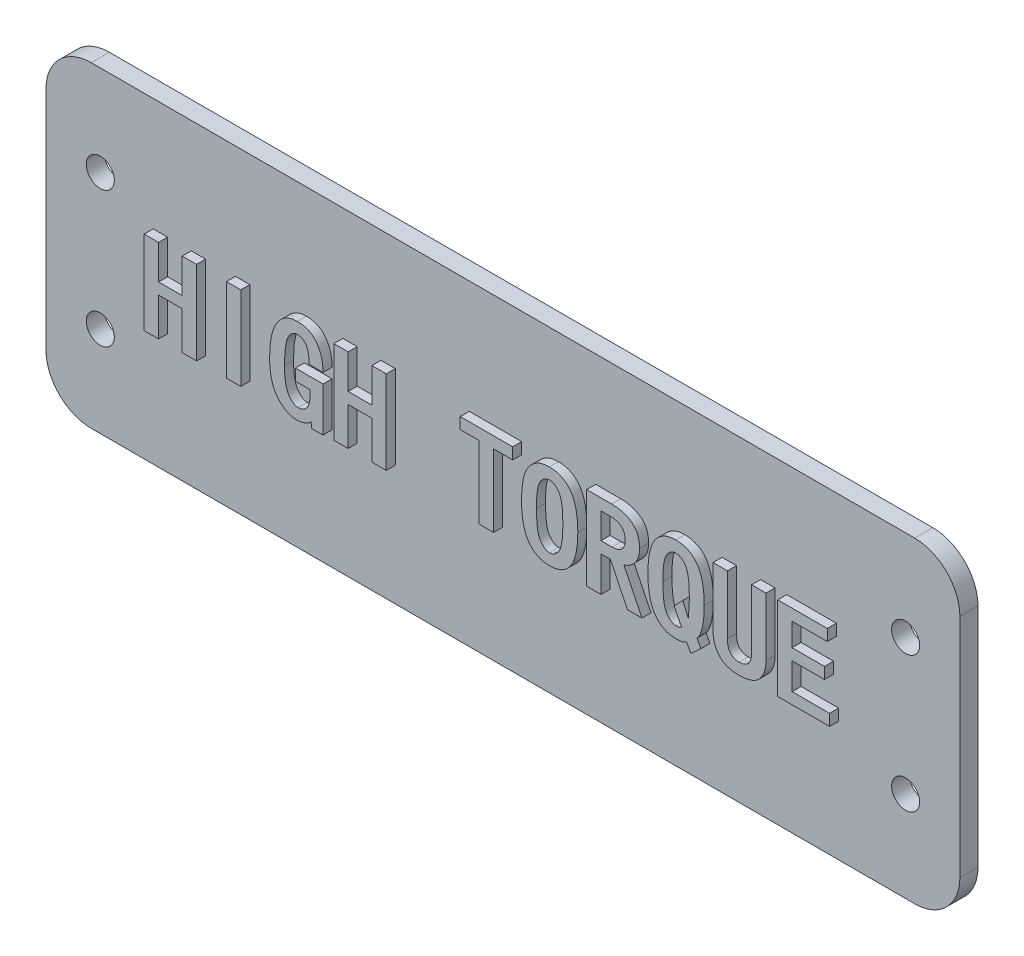
from build123d import *

# Parameters (mm, degrees)
SKETCH_1_W      = 101
SKETCH_1_H      = 35
SKETCH_1_R      = 1.55
EXTRUDE_1_DEPTH = 2
FILLET_1_R      = 5
SKETCH_3_W      = 1.589612312
SKETCH_3_H      = 9.245947265
EXTRUDE_2_DEPTH = 1


with BuildPart() as part:
    # 草图1 → 凸台-拉伸1 (new body)
    with BuildSketch(Plane.XY):
        with Locations((50.5, 17.5)):
            Rectangle(SKETCH_1_W, SKETCH_1_H)
        with Locations((6, 25)):
            Circle(SKETCH_1_R, mode=Mode.SUBTRACT)
        with Locations((95, 25)):
            Circle(SKETCH_1_R, mode=Mode.SUBTRACT)
        with Locations((95, 10)):
            Circle(SKETCH_1_R, mode=Mode.SUBTRACT)
        with Locations((6, 10)):
            Circle(SKETCH_1_R, mode=Mode.SUBTRACT)
    extrude(amount=EXTRUDE_1_DEPTH)

    # 圆角1
    fillet_1_edges = [part.edges().sort_by_distance(p)[0] for p in [
        (0, 35, 1),
        (101, 35, 1),
        (101, 0, 1),
        (0, 0, 1),
    ]]
    fillet(fillet_1_edges, radius=FILLET_1_R)

    # 草图3 → 凸台-拉伸2 (add)
    # profile 1 of 10: a face of its own
    with BuildSketch(Plane.XY.offset(2)):
        Polygon((17.64576391, 13.274972898), (16.056151598, 13.274972898), (16.056151598, 17.482186506), (13.438550301, 17.482186506), (13.438550301, 13.274972898), (11.84893799, 13.274972898), (11.84893799, 22.520920163), (13.438550301, 22.520920163), (13.438550301, 18.734427915), (16.056151598, 18.734427915), (16.056151598, 22.520920163), (17.64576391, 22.520920163), align=None)
    # profile 2 of 10: a face of its own
    with BuildSketch(Plane.XY.offset(2)):
        with Locations((21.732913168, 17.897946531)):
            Rectangle(SKETCH_3_W, SKETCH_3_H)
    # profile 3 of 10: a face of its own
    with BuildSketch(Plane.XY.offset(2)):
        with BuildLine():
            Line((31.616888347, 13.169792558), (30.366631472, 13.169792558))
            Line((30.366631472, 13.169792558), (30.275342875, 13.906054939))
            add(Edge.make_bspline(
                [(30.275342875, 13.906054939), (30.277241291, 13.884822673), (30.281095595, 13.841715367), (30.2634311, 13.776380852), (30.227897618, 13.713207135), (30.174136952, 13.652129339), (30.106994746, 13.587979048), (30.020396113, 13.526757546), (29.915979577, 13.468648749), (29.757995403, 13.385445207), (29.539984375, 13.299955526), (29.264854032, 13.223316562), (28.976856687, 13.179677826), (28.781128146, 13.173121199), (28.681761494, 13.169792558)],
                knots=[0, 0, 0, 0, 0.404685948, 0.821623142, 1.268524009, 1.779947334, 2.370127266, 3.040180568, 3.799017715, 4.652680262, 6.450666371, 8.25994717, 10.10126552, 12, 12, 12, 12], degree=3))
            add(Edge.make_bspline(
                [(28.681761494, 13.169792558), (28.585554633, 13.172309223), (28.395013568, 13.177293567), (28.114802918, 13.233654895), (27.840872812, 13.312275955), (27.577902666, 13.432731377), (27.321211741, 13.581798626), (27.076321157, 13.768038897), (26.837874627, 13.985047777), (26.6075953, 14.233097318), (26.396386493, 14.520349687), (26.210829477, 14.846086423), (26.056368921, 15.212039298), (25.933058926, 15.617635883), (25.834281467, 16.060786739), (25.763523418, 16.542914585), (25.722333947, 17.063385169), (25.717420978, 17.423235622), (25.714882086, 17.609196729)],
                knots=[0, 0, 0, 0, 0.773065135, 1.531082639, 2.292345688, 3.062030965, 3.851778445, 4.676903532, 5.532380376, 6.444095022, 7.395954845, 8.394966231, 9.453945799, 10.585438076, 11.802027254, 13.104463427, 14.503664001, 16, 16, 16, 16], degree=3))
            add(Edge.make_bspline(
                [(25.714882086, 17.609196729), (25.716639045, 17.811696683), (25.720047549, 18.204547077), (25.761240707, 18.773393523), (25.823056048, 19.303636539), (25.911483819, 19.794410429), (26.02594976, 20.247057051), (26.166038131, 20.660124378), (26.330286454, 21.035495531), (26.523095534, 21.369514335), (26.738374381, 21.665271166), (26.972091993, 21.92302213), (27.227344962, 22.140818931), (27.501914021, 22.31783205), (27.7960308, 22.45701407), (28.10881411, 22.556533447), (28.442114193, 22.614762101), (28.670285397, 22.622264681), (28.786941834, 22.626100504)],
                knots=[0, 0, 0, 0, 1.472579312, 2.856807383, 4.145874486, 5.353858625, 6.481139869, 7.538614218, 8.522994793, 9.456374208, 10.33790306, 11.179077366, 11.981201368, 12.77128672, 13.548253789, 14.341030196, 15.151823267, 16, 16, 16, 16], degree=3))
            add(Edge.make_bspline(
                [(28.786941834, 22.626100504), (28.897545102, 22.622843833), (29.11302432, 22.616499131), (29.427398012, 22.573129068), (29.721205737, 22.497344714), (29.996726919, 22.394647214), (30.250325488, 22.258184184), (30.484373271, 22.09229846), (30.698155116, 21.896096413), (30.889897286, 21.671249016), (31.060386471, 21.422513479), (31.208497424, 21.154122291), (31.337091774, 20.868650669), (31.440110237, 20.563495789), (31.518438026, 20.239181775), (31.576213853, 19.897088648), (31.609850968, 19.536854452), (31.614507916, 19.290829328), (31.616888347, 19.16507195)],
                knots=[0, 0, 0, 0, 1.051035015, 2.04764478, 3.008212116, 3.92940237, 4.83501697, 5.736805181, 6.64894196, 7.585132314, 8.538949328, 9.509788216, 10.494670874, 11.510525019, 12.565613027, 13.662137341, 14.804985951, 16, 16, 16, 16], degree=3))
            Line((31.616888347, 19.16507195), (30.078873938, 19.16507195))
            add(Edge.make_bspline(
                [(30.078873938, 19.16507195), (30.077673814, 19.260354545), (30.075355163, 19.444441493), (30.059317865, 19.709947983), (30.034576911, 19.95522447), (29.99732455, 20.178627838), (29.949500395, 20.38080514), (29.89350262, 20.562282858), (29.823319275, 20.722144221), (29.744500478, 20.8626437), (29.653663375, 20.982755672), (29.555511932, 21.087651684), (29.449088618, 21.176623585), (29.333469805, 21.250468852), (29.208526507, 21.304897871), (29.075451258, 21.345462069), (28.934006463, 21.36949292), (28.836647156, 21.372383402), (28.786941834, 21.373859095)],
                knots=[0, 0, 0, 0, 1.586046448, 3.064257943, 4.42625607, 5.688059039, 6.831221944, 7.882951832, 8.844517848, 9.732319319, 10.558205968, 11.34499275, 12.119038461, 12.861418226, 13.620595308, 14.380011941, 15.172939591, 16, 16, 16, 16], degree=3))
            add(Edge.make_bspline(
                [(28.786941834, 21.373859095), (28.733772731, 21.371859936), (28.629326974, 21.367932776), (28.47697188, 21.327835511), (28.333605104, 21.264132539), (28.197459016, 21.174386612), (28.071864863, 21.058649375), (27.952715802, 20.918675019), (27.842767435, 20.75400089), (27.740085525, 20.562410993), (27.648066745, 20.338764503), (27.569746075, 20.078182986), (27.506292239, 19.778466936), (27.449907035, 19.440963946), (27.410948898, 19.063733219), (27.378074651, 18.648271401), (27.361407805, 18.19410854), (27.359216005, 17.878442105), (27.358076835, 17.714377069)],
                knots=[0, 0, 0, 0, 0.593539068, 1.16595228, 1.748883274, 2.341914906, 2.980929397, 3.652601944, 4.393372111, 5.19110308, 6.080058068, 7.093430964, 8.229738948, 9.50442286, 10.918690183, 12.469492685, 14.165047836, 16, 16, 16, 16], degree=3))
            add(Edge.make_bspline(
                [(27.358076835, 17.714377069), (27.359636255, 17.558894979), (27.362617412, 17.261658552), (27.384007062, 16.835235922), (27.420417247, 16.448264089), (27.473864434, 16.100485376), (27.539307432, 15.79136603), (27.622566041, 15.522482548), (27.717473869, 15.290963509), (27.833334994, 15.100055099), (27.956299721, 14.940543487), (28.078931707, 14.803014819), (28.202842587, 14.686412944), (28.327327973, 14.590366155), (28.453583159, 14.516165881), (28.57965944, 14.460974265), (28.70846323, 14.427423692), (28.795352625, 14.423823426), (28.838539737, 14.422033967)],
                knots=[0, 0, 0, 0, 1.891237509, 3.615494755, 5.192022928, 6.616848772, 7.893733796, 9.03138948, 10.037253368, 10.928726721, 11.738245671, 12.484678521, 13.167838939, 13.805152193, 14.393053725, 14.944587119, 15.475422364, 16, 16, 16, 16], degree=3))
            add(Edge.make_bspline(
                [(28.838539737, 14.422033967), (28.888864769, 14.423887952), (28.987912317, 14.427536886), (29.132617449, 14.446426437), (29.269439675, 14.482263502), (29.396381305, 14.535048778), (29.517374651, 14.598172179), (29.628600691, 14.67797818), (29.73038295, 14.773258029), (29.826612231, 14.880165625), (29.912614633, 15.004419306), (29.986133445, 15.146600483), (30.046257519, 15.306273136), (30.099153894, 15.480903775), (30.13454043, 15.674168302), (30.165868912, 15.883076982), (30.180104173, 16.110019828), (30.182709076, 16.266318337), (30.184054278, 16.347032646)],
                knots=[0, 0, 0, 0, 0.907406556, 1.78591827, 2.624610233, 3.448251036, 4.259018942, 5.079547088, 5.906460763, 6.767896505, 7.667514695, 8.62210419, 9.645058048, 10.739124451, 11.905940461, 13.182376014, 14.544947275, 16, 16, 16, 16], degree=3))
            Line((30.184054278, 16.347032646), (30.184054278, 16.797522028))
            Line((30.184054278, 16.797522028), (28.554751272, 16.797522028))
            Line((28.554751272, 16.797522028), (28.554751272, 18.051747971))
            Line((28.554751272, 18.051747971), (31.616888347, 18.051747971))
            Line((31.616888347, 18.051747971), (31.616888347, 13.169792558))
        make_face()
    # profile 4 of 10: a face of its own
    with BuildSketch(Plane.XY.offset(2)):
        Polygon((38.602450565, 13.274972898), (37.012838253, 13.274972898), (37.012838253, 17.482186506), (34.395236956, 17.482186506), (34.395236956, 13.274972898), (32.805624644, 13.274972898), (32.805624644, 22.520920163), (34.395236956, 22.520920163), (34.395236956, 18.734427915), (37.012838253, 18.734427915), (37.012838253, 22.520920163), (38.602450565, 22.520920163), align=None)
    # profile 5 of 10: a face of its own
    with BuildSketch(Plane.XY.offset(2)):
        Polygon((52.573575001, 21.268678754), (50.469968197, 21.268678754), (50.469968197, 13.274972898), (48.880355885, 13.274972898), (48.880355885, 21.268678754), (46.776749081, 21.268678754), (46.776749081, 22.520920163), (52.573575001, 22.520920163), align=None)
    # profile 6 of 10: a face of its own
    with BuildSketch(Plane.XY.offset(2)):
        with BuildLine():
            add(Edge.make_bspline(
                [(59.7694979, 17.924737749), (59.767529619, 17.724900678), (59.763732607, 17.339394764), (59.725849147, 16.78156005), (59.662944962, 16.266160245), (59.577835951, 15.790623188), (59.462076169, 15.358690562), (59.327529575, 14.965687006), (59.162057886, 14.616887258), (58.97346876, 14.307787991), (58.758231474, 14.039016743), (58.522285011, 13.804808985), (58.260845669, 13.609197577), (57.979512268, 13.445655092), (57.672021841, 13.323257082), (57.343237607, 13.234002845), (56.990982713, 13.179286062), (56.748575035, 13.173015022), (56.624010367, 13.169792558)],
                knots=[0, 0, 0, 0, 1.482109731, 2.859139507, 4.144502331, 5.332081044, 6.438947973, 7.458510704, 8.408862517, 9.296700438, 10.13809231, 10.956934706, 11.755744593, 12.553619618, 13.363638007, 14.202809372, 15.076487773, 16, 16, 16, 16], degree=3))
            add(Edge.make_bspline(
                [(56.624010367, 13.169792558), (56.50739223, 13.173229027), (56.279586283, 13.179941946), (55.947756072, 13.232198306), (55.635076725, 13.319604701), (55.34198792, 13.443492952), (55.067273772, 13.60111379), (54.813331329, 13.796205363), (54.578825894, 14.025828573), (54.362174889, 14.290212481), (54.168270547, 14.594531844), (54.002277533, 14.942813633), (53.862085868, 15.333979371), (53.74808939, 15.768405733), (53.659596686, 16.246045508), (53.598250723, 16.76713938), (53.556966312, 17.331359725), (53.553662328, 17.722235156), (53.551950619, 17.924737749)],
                knots=[0, 0, 0, 0, 0.874151028, 1.707597178, 2.511592069, 3.302955925, 4.087402855, 4.880086984, 5.697391014, 6.543377942, 7.437785054, 8.396186257, 9.43022448, 10.549184097, 11.760398197, 13.069650641, 14.481860717, 16, 16, 16, 16], degree=3))
            add(Edge.make_bspline(
                [(53.551950619, 17.924737749), (53.55364424, 18.12724153), (53.556907787, 18.517459243), (53.598275523, 19.080352215), (53.659404225, 19.598841764), (53.748054225, 20.073178854), (53.862127613, 20.503619392), (54.001804127, 20.890431067), (54.168304085, 21.233304071), (54.362212583, 21.531707285), (54.578916112, 21.790145771), (54.814228385, 22.014367859), (55.069077352, 22.204497236), (55.34413345, 22.357586982), (55.636164114, 22.481201392), (55.949328789, 22.565378762), (56.281057601, 22.615389794), (56.5080697, 22.622479577), (56.624010367, 22.626100504)],
                knots=[0, 0, 0, 0, 1.527865662, 2.944143763, 4.256829192, 5.465991544, 6.582474552, 7.613756025, 8.564832938, 9.452382312, 10.292251896, 11.104410477, 11.900155737, 12.684688649, 13.474587384, 14.287206103, 15.125233996, 16, 16, 16, 16], degree=3))
            add(Edge.make_bspline(
                [(56.624010367, 22.626100504), (56.747884088, 22.622644705), (56.989473877, 22.615904892), (57.340553903, 22.56427377), (57.668531112, 22.476259636), (57.975829459, 22.355810842), (58.257957139, 22.195224489), (58.519471441, 22.003105599), (58.7569045, 21.774952961), (58.970719839, 21.510247622), (59.160347896, 21.207121012), (59.325327183, 20.863101978), (59.463021591, 20.476323313), (59.574966628, 20.047115722), (59.663687266, 19.576341562), (59.725729576, 19.063251858), (59.763782794, 18.508110811), (59.767546601, 18.123917821), (59.7694979, 17.924737749)],
                knots=[0, 0, 0, 0, 0.924837789, 1.803702718, 2.64250372, 3.456170252, 4.261304483, 5.059620579, 5.873691894, 6.713089084, 7.594366387, 8.53779121, 9.556616881, 10.655395167, 11.847077938, 13.131347985, 14.512783083, 16, 16, 16, 16], degree=3))
        make_face()
        with BuildLine():
            add(Edge.make_bspline(
                [(58.126303151, 17.924737749), (58.125717154, 18.097429024), (58.124598507, 18.427090358), (58.101154082, 18.897548353), (58.070477556, 19.321029204), (58.019840256, 19.69624411), (57.962045182, 20.024906946), (57.883426848, 20.30438852), (57.798315503, 20.54017991), (57.689482756, 20.728481885), (57.573898374, 20.882482866), (57.453295637, 21.011700142), (57.331217401, 21.12582782), (57.198369985, 21.214021823), (57.063861795, 21.287537133), (56.921850077, 21.337567806), (56.774839188, 21.368180327), (56.674432136, 21.371960694), (56.624010367, 21.373859095)],
                knots=[0, 0, 0, 0, 1.990561811, 3.799909783, 5.42944937, 6.8833502, 8.16368396, 9.272000238, 10.227982531, 11.044303368, 11.768789503, 12.443393091, 13.080532084, 13.689719391, 14.276488615, 14.843344441, 15.419158142, 16, 16, 16, 16], degree=3))
            add(Edge.make_bspline(
                [(56.624010367, 21.373859095), (56.58082751, 21.371984943), (56.494102585, 21.36822105), (56.366105163, 21.336243887), (56.239663522, 21.28863505), (56.115254413, 21.220049583), (55.994974435, 21.13006997), (55.877490053, 21.020969393), (55.759497999, 20.89535859), (55.641675875, 20.74684249), (55.530552306, 20.561854409), (55.443551345, 20.327769127), (55.363180146, 20.048200046), (55.302890042, 19.718290714), (55.253693451, 19.339425319), (55.218756943, 18.911614522), (55.200290438, 18.434266667), (55.196915658, 18.10005392), (55.195145368, 17.924737749)],
                knots=[0, 0, 0, 0, 0.505350126, 1.014903928, 1.537498455, 2.085627625, 2.673226187, 3.293218191, 3.962295112, 4.691121428, 5.511376175, 6.478696049, 7.607363091, 8.917838952, 10.40336002, 12.083534637, 13.945560975, 16, 16, 16, 16], degree=3))
            add(Edge.make_bspline(
                [(55.195145368, 17.924737749), (55.196928492, 17.749422559), (55.20033446, 17.414550759), (55.218713227, 16.935871253), (55.253914151, 16.505458584), (55.302603648, 16.123863747), (55.363802007, 15.790221629), (55.443608801, 15.505930908), (55.530689017, 15.266094006), (55.641666537, 15.07508799), (55.759687656, 14.920778447), (55.876950336, 14.788456408), (55.996235007, 14.676425101), (56.117634714, 14.58395438), (56.241072369, 14.512209506), (56.365771891, 14.458400777), (56.494213713, 14.427970859), (56.58086445, 14.424007459), (56.624010367, 14.422033967)],
                knots=[0, 0, 0, 0, 2.033443565, 3.884106689, 5.55475678, 7.040311688, 8.344929666, 9.484211649, 10.463079269, 11.294829006, 12.034459399, 12.713681337, 13.34338732, 13.929568172, 14.479638653, 14.995467943, 15.499814329, 16, 16, 16, 16], degree=3))
            add(Edge.make_bspline(
                [(56.624010367, 14.422033967), (56.674479418, 14.423684736), (56.774469001, 14.426955252), (56.92112873, 14.461149857), (57.063360713, 14.512037311), (57.198861062, 14.587078098), (57.329439151, 14.681702948), (57.454060151, 14.79745054), (57.573687795, 14.933733363), (57.689529254, 15.09339768), (57.797707232, 15.287274386), (57.883822981, 15.527804813), (57.961608136, 15.812169383), (58.01990343, 16.145284123), (58.070306232, 16.523848714), (58.101183225, 16.949938632), (58.124555382, 17.421727127), (58.125703119, 17.752047466), (58.126303151, 17.924737749)],
                knots=[0, 0, 0, 0, 0.574986621, 1.139166893, 1.709975355, 2.294399898, 2.899945474, 3.546413648, 4.23103093, 4.966457664, 5.794302319, 6.754755225, 7.873732678, 9.156001892, 10.610216079, 12.230854396, 14.029504255, 16, 16, 16, 16], degree=3))
        make_face(mode=Mode.SUBTRACT)
    # profile 7 of 10: a face of its own
    with BuildSketch(Plane.XY.offset(2)):
        with BuildLine():
            Line((66.860240459, 13.274972898), (65.264674543, 13.274972898))
            Line((65.264674543, 13.274972898), (63.371428419, 17.166645486))
            Line((63.371428419, 17.166645486), (62.337485829, 17.166645486))
            Line((62.337485829, 17.166645486), (62.337485829, 13.274972898))
            Line((62.337485829, 13.274972898), (60.747873518, 13.274972898))
            Line((60.747873518, 13.274972898), (60.747873518, 22.520920163))
            Line((60.747873518, 22.520920163), (63.504392245, 22.520920163))
            add(Edge.make_bspline(
                [(63.504392245, 22.520920163), (63.616267362, 22.519256018), (63.83585836, 22.515989595), (64.156788541, 22.483318354), (64.46184227, 22.431978938), (64.750507015, 22.361753148), (65.022131149, 22.266998368), (65.278375438, 22.154838661), (65.518564372, 22.020990176), (65.740431154, 21.866742401), (65.943432423, 21.69221999), (66.11928486, 21.491624434), (66.268832147, 21.268222173), (66.390538124, 21.021940678), (66.483602932, 20.753032352), (66.550968822, 20.461773159), (66.590322248, 20.147167857), (66.595575959, 19.929891675), (66.598281875, 19.817983873)],
                knots=[0, 0, 0, 0, 1.148759788, 2.254811588, 3.309261259, 4.324362488, 5.302027667, 6.260258016, 7.194064775, 8.121397626, 9.031571282, 9.936633206, 10.852469905, 11.785312154, 12.75014403, 13.768673017, 14.85075808, 16, 16, 16, 16], degree=3))
            add(Edge.make_bspline(
                [(66.598281875, 19.817983873), (66.597260335, 19.73122827), (66.595273896, 19.562527353), (66.565323004, 19.316645395), (66.523231454, 19.083981111), (66.46137109, 18.864765493), (66.382808892, 18.659430838), (66.283519121, 18.469856936), (66.171466769, 18.290891004), (65.995896652, 18.081450523), (65.765196101, 17.852121649), (65.472246697, 17.631629382), (65.173432084, 17.466812851), (64.963782982, 17.407728236), (64.861813994, 17.378990701)],
                knots=[0, 0, 0, 0, 0.964907686, 1.876314665, 2.752796666, 3.594192433, 4.407682314, 5.1946542, 5.972760075, 6.752362209, 8.230878858, 9.582593576, 10.82422351, 12, 12, 12, 12], degree=3))
            Line((64.861813994, 17.378990701), (66.860240459, 13.274972898))
        make_face()
        with BuildLine():
            add(Edge.make_bspline(
                [(65.006685029, 19.817983873), (65.005765195, 19.872955326), (65.003963445, 19.980632103), (64.983364772, 20.137306283), (64.951612174, 20.285354381), (64.908689955, 20.424886319), (64.850831128, 20.554859679), (64.778953585, 20.674432878), (64.694311598, 20.78413073), (64.599584621, 20.887283506), (64.48617952, 20.976383227), (64.359343915, 21.056882983), (64.213609846, 21.121468841), (64.052793614, 21.177971079), (63.872845476, 21.218315038), (63.676524211, 21.247599235), (63.463709113, 21.265558956), (63.316558684, 21.267615212), (63.240449127, 21.268678754)],
                knots=[0, 0, 0, 0, 1.007223095, 1.972924709, 2.891082177, 3.78093177, 4.644102437, 5.492666792, 6.331907418, 7.181251346, 8.052477712, 8.967747381, 9.928257013, 10.967602609, 12.088377626, 13.302683037, 14.604886165, 16, 16, 16, 16], degree=3))
            Line((63.240449127, 21.268678754), (62.337485829, 21.268678754))
            Line((62.337485829, 21.268678754), (62.337485829, 18.418886895))
            Line((62.337485829, 18.418886895), (63.555990148, 18.418886895))
            add(Edge.make_bspline(
                [(63.555990148, 18.418886895), (63.651524919, 18.422692391), (63.837799646, 18.430112387), (64.107055632, 18.488142038), (64.354255103, 18.587484949), (64.544200232, 18.698910085), (64.679549277, 18.811270093), (64.768468577, 18.912006088), (64.84116158, 19.028828587), (64.903904231, 19.157935713), (64.948550321, 19.303464891), (64.981540225, 19.462249774), (65.004706091, 19.635403028), (65.006010182, 19.755721139), (65.006685029, 19.817983873)],
                knots=[0, 0, 0, 0, 1.494575167, 2.914138778, 4.285025422, 5.650544701, 6.341246509, 7.030860964, 7.743187035, 8.488822993, 9.27142814, 10.118248294, 11.026223015, 12, 12, 12, 12], degree=3))
        make_face(mode=Mode.SUBTRACT)
    # profile 8 of 10: a face of its own
    with BuildSketch(Plane.XY.offset(2)):
        with BuildLine():
            add(Edge.make_bspline(
                [(73.740622337, 17.924737749), (73.738328029, 17.723591592), (73.733917064, 17.336874225), (73.700806172, 16.780465543), (73.644234056, 16.270854509), (73.564412517, 15.806975021), (73.458752209, 15.387918261), (73.324401427, 15.01320827), (73.160190435, 14.681704107), (73.020259507, 14.490465779), (72.952762052, 14.39821955)],
                knots=[0, 0, 0, 0, 1.313225825, 2.524767263, 3.63749796, 4.659281525, 5.595773583, 6.455163916, 7.254828755, 8, 8, 8, 8], degree=3))
            Line((72.952762052, 14.39821955), (73.373483413, 13.606390196))
            Line((73.373483413, 13.606390196), (72.280004782, 12.590308419))
            Line((72.280004782, 12.590308419), (71.781886567, 13.485333578))
            add(Edge.make_bspline(
                [(71.781886567, 13.485333578), (71.770845404, 13.46286891), (71.744731789, 13.409737395), (71.65376477, 13.354578586), (71.531086846, 13.300861976), (71.30821178, 13.241197171), (70.992869862, 13.183270395), (70.729777118, 13.17435511), (70.595134804, 13.169792558)],
                knots=[0, 0, 0, 0, 0.349724203, 0.827137823, 1.454012618, 2.265937234, 4.089028046, 6, 6, 6, 6], degree=3))
            add(Edge.make_bspline(
                [(70.595134804, 13.169792558), (70.478516666, 13.173229027), (70.25071072, 13.179941946), (69.918880508, 13.232198306), (69.606201162, 13.319604701), (69.313112356, 13.443492952), (69.038398208, 13.60111379), (68.784455765, 13.796205363), (68.54995033, 14.025828573), (68.333299326, 14.290212481), (68.139394984, 14.594531844), (67.973401969, 14.942813633), (67.833210304, 15.333979371), (67.719213826, 15.768405733), (67.630721122, 16.246045508), (67.56937516, 16.76713938), (67.528090748, 17.331359725), (67.524786765, 17.722235156), (67.523075055, 17.924737749)],
                knots=[0, 0, 0, 0, 0.874151028, 1.707597178, 2.511592069, 3.302955925, 4.087402855, 4.880086984, 5.697391014, 6.543377942, 7.437785054, 8.396186257, 9.43022448, 10.549184097, 11.760398197, 13.069650641, 14.481860717, 16, 16, 16, 16], degree=3))
            add(Edge.make_bspline(
                [(67.523075055, 17.924737749), (67.524768676, 18.12724153), (67.528032224, 18.517459243), (67.56939996, 19.080352215), (67.630528662, 19.598841764), (67.719178662, 20.073178854), (67.833252049, 20.503619392), (67.972928564, 20.890431067), (68.139428521, 21.233304071), (68.333337019, 21.531707285), (68.550040548, 21.790145771), (68.785352822, 22.014367859), (69.040201789, 22.204497236), (69.315257886, 22.357586982), (69.607288551, 22.481201392), (69.920453226, 22.565378762), (70.252182038, 22.615389794), (70.479194137, 22.622479577), (70.595134804, 22.626100504)],
                knots=[0, 0, 0, 0, 1.527865662, 2.944143763, 4.256829192, 5.465991544, 6.582474552, 7.613756025, 8.564832938, 9.452382312, 10.292251896, 11.104410477, 11.900155737, 12.684688649, 13.474587384, 14.287206103, 15.125233996, 16, 16, 16, 16], degree=3))
            add(Edge.make_bspline(
                [(70.595134804, 22.626100504), (70.719008524, 22.622644705), (70.960598313, 22.615904892), (71.31167834, 22.56427377), (71.639655548, 22.476259636), (71.946953895, 22.355810842), (72.229081575, 22.195224489), (72.490595877, 22.003105599), (72.728028937, 21.774952961), (72.941844275, 21.510247622), (73.131472332, 21.207121012), (73.29645162, 20.863101978), (73.434146027, 20.476323313), (73.546091065, 20.047115722), (73.634811702, 19.576341562), (73.696854012, 19.063251858), (73.734907231, 18.508110811), (73.738671038, 18.123917821), (73.740622337, 17.924737749)],
                knots=[0, 0, 0, 0, 0.924837789, 1.803702718, 2.64250372, 3.456170252, 4.261304483, 5.059620579, 5.873691894, 6.713089084, 7.594366387, 8.53779121, 9.556616881, 10.655395167, 11.847077938, 13.131347985, 14.512783083, 16, 16, 16, 16], degree=3))
        make_face()
        with BuildLine():
            add(Edge.make_bspline(
                [(72.097427588, 17.924737749), (72.096841591, 18.097429024), (72.095722943, 18.427090358), (72.072278519, 18.897548353), (72.041601993, 19.321029204), (71.990964692, 19.69624411), (71.933169619, 20.024906946), (71.854551285, 20.30438852), (71.769439939, 20.54017991), (71.660607193, 20.728481885), (71.54502281, 20.882482866), (71.424420074, 21.011700142), (71.302341838, 21.12582782), (71.169494422, 21.214021823), (71.034986231, 21.287537133), (70.892974514, 21.337567806), (70.745963625, 21.368180327), (70.645556572, 21.371960694), (70.595134804, 21.373859095)],
                knots=[0, 0, 0, 0, 1.990561811, 3.799909783, 5.42944937, 6.8833502, 8.16368396, 9.272000238, 10.227982531, 11.044303368, 11.768789503, 12.443393091, 13.080532084, 13.689719391, 14.276488615, 14.843344441, 15.419158142, 16, 16, 16, 16], degree=3))
            add(Edge.make_bspline(
                [(70.595134804, 21.373859095), (70.551951946, 21.371984943), (70.465227022, 21.36822105), (70.3372296, 21.336243887), (70.210787959, 21.28863505), (70.086378849, 21.220049583), (69.966098871, 21.13006997), (69.84861449, 21.020969393), (69.730622436, 20.89535859), (69.612800312, 20.74684249), (69.501676742, 20.561854409), (69.414675781, 20.327769127), (69.334304582, 20.048200046), (69.274014478, 19.718290714), (69.224817888, 19.339425319), (69.18988138, 18.911614522), (69.171414875, 18.434266667), (69.168040095, 18.10005392), (69.166269805, 17.924737749)],
                knots=[0, 0, 0, 0, 0.505350126, 1.014903928, 1.537498455, 2.085627625, 2.673226187, 3.293218191, 3.962295112, 4.691121428, 5.511376175, 6.478696049, 7.607363091, 8.917838952, 10.40336002, 12.083534637, 13.945560975, 16, 16, 16, 16], degree=3))
            add(Edge.make_bspline(
                [(69.166269805, 17.924737749), (69.168052929, 17.749422559), (69.171458897, 17.414550759), (69.189837664, 16.935871253), (69.225038588, 16.505458584), (69.273728084, 16.123863747), (69.334926443, 15.790221629), (69.414733237, 15.505930908), (69.501813454, 15.266094006), (69.612790974, 15.07508799), (69.730812092, 14.920778447), (69.848074773, 14.788456408), (69.967359444, 14.676425101), (70.088759151, 14.58395438), (70.212196805, 14.512209506), (70.336896327, 14.458400777), (70.46533815, 14.427970859), (70.551988887, 14.424007459), (70.595134804, 14.422033967)],
                knots=[0, 0, 0, 0, 2.033443565, 3.884106689, 5.55475678, 7.040311688, 8.344929666, 9.484211649, 10.463079269, 11.294829006, 12.034459399, 12.713681337, 13.34338732, 13.929568172, 14.479638653, 14.995467943, 15.499814329, 16, 16, 16, 16], degree=3))
            add(Edge.make_bspline(
                [(70.595134804, 14.422033967), (70.671516274, 14.425229782), (70.815509639, 14.431254492), (70.985305598, 14.474004349), (71.097623995, 14.519910793), (71.165552965, 14.543652597), (71.215125513, 14.567468866), (71.244017438, 14.578296377), (71.255984866, 14.582781279)],
                knots=[0, 0, 0, 0, 2.003614726, 3.777188734, 4.557856307, 5.190120219, 5.664536811, 6, 6, 6, 6], degree=3))
            Line((71.255984866, 14.582781279), (70.414542144, 16.204146146))
            Line((70.414542144, 16.204146146), (71.369103345, 17.21030525))
            Line((71.369103345, 17.21030525), (71.990262713, 15.789378389))
            add(Edge.make_bspline(
                [(71.990262713, 15.789378389), (71.992785143, 15.92776569), (71.997864123, 16.206412143), (72.037455537, 16.563466034), (72.0720226, 16.88164611), (72.084998084, 17.179113392), (72.095306612, 17.533044555), (72.09668604, 17.787791779), (72.097427588, 17.924737749)],
                knots=[0, 0, 0, 0, 1.163972022, 2.343688134, 3.020492992, 3.856598046, 4.847758751, 6, 6, 6, 6], degree=3))
        make_face(mode=Mode.SUBTRACT)
    # profile 9 of 10: a face of its own
    with BuildSketch(Plane.XY.offset(2)):
        with BuildLine():
            add(Edge.make_bspline(
                [(80.569406312, 16.031491625), (80.566834662, 15.928227609), (80.56179446, 15.725839484), (80.530649147, 15.428873348), (80.474742572, 15.146860438), (80.398406282, 14.879056196), (80.295337161, 14.628305707), (80.174851488, 14.389816673), (80.02908437, 14.167464977), (79.862417646, 13.959997637), (79.671762588, 13.770821616), (79.450473622, 13.610293476), (79.204614647, 13.471644803), (78.93047302, 13.361937697), (78.630960051, 13.273743713), (78.30429667, 13.214421728), (77.951432571, 13.175334918), (77.70716034, 13.171683138), (77.580697022, 13.169792558)],
                knots=[0, 0, 0, 0, 1.049678188, 2.05727424, 3.030428909, 3.968793518, 4.882751684, 5.781873702, 6.680769428, 7.579640007, 8.483025787, 9.401523426, 10.349784623, 11.344920117, 12.39597561, 13.518194978, 14.715133122, 16, 16, 16, 16], degree=3))
            add(Edge.make_bspline(
                [(77.580697022, 13.169792558), (77.46153854, 13.171983209), (77.230591034, 13.17622903), (76.89647544, 13.211514759), (76.586888908, 13.272755544), (76.302042073, 13.358459447), (76.039664265, 13.464180766), (75.802963107, 13.598535308), (75.591806184, 13.757709265), (75.405476182, 13.940711874), (75.243100935, 14.143115556), (75.103406989, 14.364089405), (74.983509459, 14.601016712), (74.887231066, 14.855430223), (74.810833223, 15.125602821), (74.758877379, 15.412735241), (74.723226658, 15.71637853), (74.72042865, 15.924879548), (74.718997954, 16.031491625)],
                knots=[0, 0, 0, 0, 1.236673456, 2.396863776, 3.482263635, 4.507618861, 5.480569489, 6.412328647, 7.324216516, 8.217665733, 9.116324303, 10.011618674, 10.926732466, 11.867856779, 12.830870629, 13.836891151, 14.893945314, 16, 16, 16, 16], degree=3))
            Line((74.718997954, 16.031491625), (74.718997954, 22.520920163))
            Line((74.718997954, 22.520920163), (76.308610266, 22.520920163))
            Line((76.308610266, 22.520920163), (76.308610266, 16.031491625))
            add(Edge.make_bspline(
                [(76.308610266, 16.031491625), (76.309941449, 15.960695529), (76.312507816, 15.824208801), (76.32671486, 15.627607148), (76.357688446, 15.447498095), (76.396339448, 15.283396768), (76.445512097, 15.133641971), (76.508939069, 15.001435803), (76.582513169, 14.883861037), (76.696266257, 14.753047667), (76.859904599, 14.620674087), (77.080700781, 14.505775091), (77.323418278, 14.432492797), (77.493509075, 14.425578309), (77.580697022, 14.422033967)],
                knots=[0, 0, 0, 0, 1.092213725, 2.105662415, 3.036653113, 3.907791589, 4.704783169, 5.462395817, 6.164370539, 6.837266504, 8.128091873, 9.38317556, 10.658624959, 12, 12, 12, 12], degree=3))
            add(Edge.make_bspline(
                [(77.580697022, 14.422033967), (77.68103033, 14.426199682), (77.873908461, 14.434207745), (78.148735945, 14.507075239), (78.390545831, 14.630471082), (78.566962757, 14.770321197), (78.68502043, 14.908059976), (78.766041407, 15.025330031), (78.829878271, 15.160293645), (78.886287966, 15.306423984), (78.927481458, 15.467705941), (78.956814342, 15.64294471), (78.974598082, 15.832672974), (78.976718974, 15.963978637), (78.977809466, 16.031491625)],
                knots=[0, 0, 0, 0, 1.48530975, 2.85532068, 4.175290742, 5.486160604, 6.160467588, 6.859419985, 7.591759142, 8.367577707, 9.178600007, 10.053936258, 10.999398994, 12, 12, 12, 12], degree=3))
            Line((78.977809466, 16.031491625), (78.977809466, 22.520920163))
            Line((78.977809466, 22.520920163), (80.569406312, 22.520920163))
            Line((80.569406312, 22.520920163), (80.569406312, 16.031491625))
        make_face()
    # profile 10 of 10: a face of its own
    with BuildSketch(Plane.XY.offset(2)):
        Polygon((87.606566433, 13.274972898), (81.861338415, 13.274972898), (81.861338415, 22.520920163), (87.34460785, 22.520920163), (87.34460785, 21.268678754), (83.452935262, 21.268678754), (83.452935262, 18.734427915), (87.029066829, 18.734427915), (87.029066829, 17.482186506), (83.452935262, 17.482186506), (83.452935262, 14.527214307), (87.606566433, 14.527214307), align=None)
    extrude(amount=EXTRUDE_2_DEPTH)


solid = part.part
